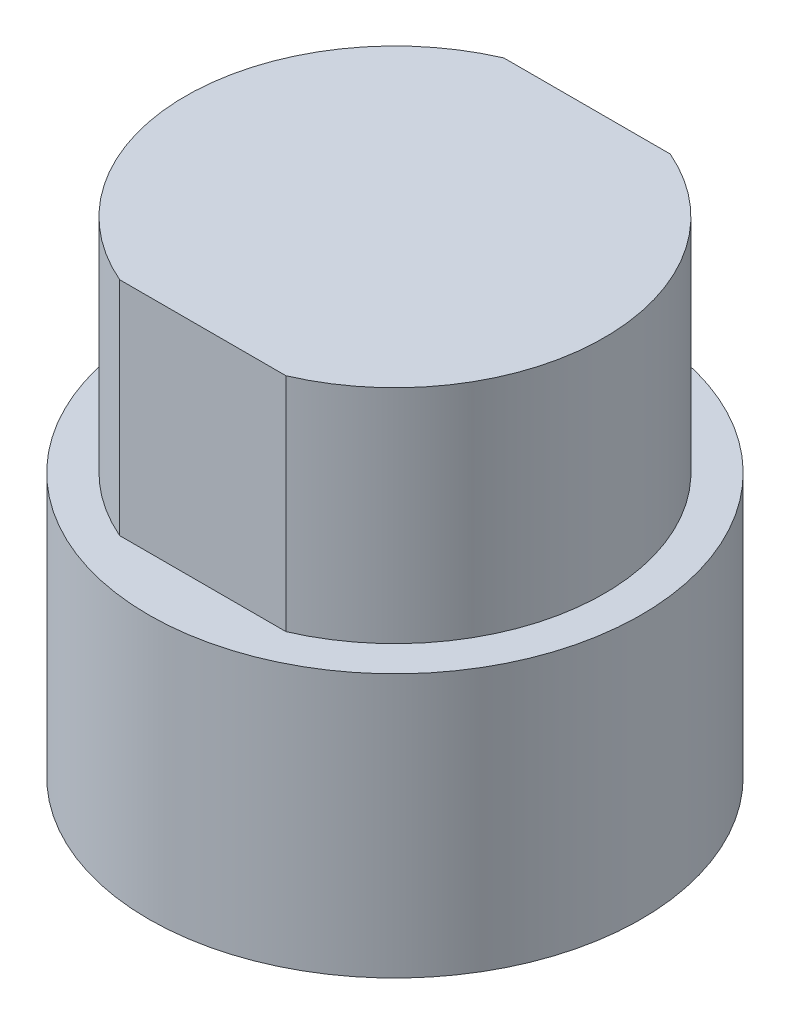
from build123d import *

# Parameters (mm, degrees)
SKETCH1_R           = 10
BOSS_EXTRUDE1_DEPTH = 10.7
BOSS_EXTRUDE2_DEPTH = 9


with BuildPart() as part:
    # Sketch1 → Boss-Extrude1 (new body)
    with BuildSketch(Plane(origin=(0, 0, 0), x_dir=(1, 0, 0), z_dir=(0, 1, 0))):
        with Locations(Location((0, 0, 0), (0, 0, 270))):
            Circle(SKETCH1_R)
    extrude(amount=BOSS_EXTRUDE1_DEPTH)

    # Sketch2 → Boss-Extrude2 (add)
    with BuildSketch(Plane(origin=(0, 10.7, 0), x_dir=(1, 0, 0), z_dir=(0, 1, 0))):
        with BuildLine():
            ThreePointArc((-3.377869151, 7.8), (-8.5, 0), (-3.377869151, -7.8))
            Line((-3.377869151, -7.8), (3.377869151, -7.8))
            ThreePointArc((3.377869151, -7.8), (8.5, 0), (3.377869151, 7.8))
            Line((3.377869151, 7.8), (-3.377869151, 7.8))
        make_face()
    extrude(amount=BOSS_EXTRUDE2_DEPTH)


solid = part.part
